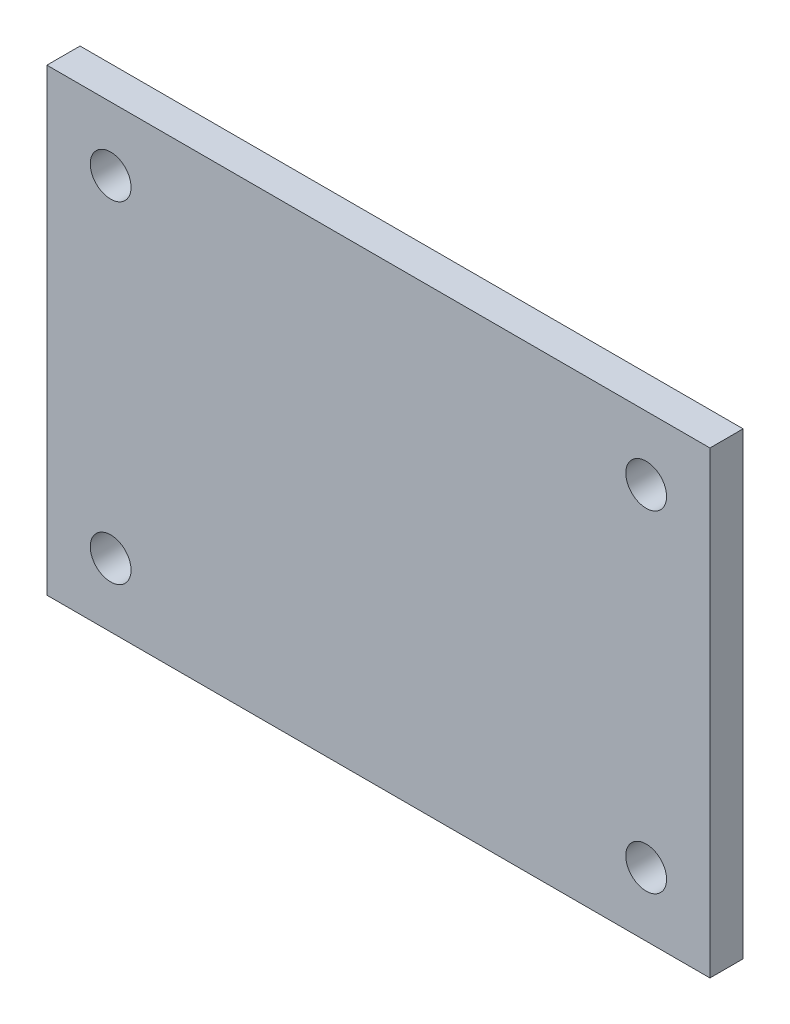
from build123d import *

# Parameters (mm, degrees)
ESQUISSE1_W               = 26
ESQUISSE1_H               = 18
BOSS_EXTRU_1_DEPTH        = 1.3
TROU_TARAUD_M2X0_41_D     = 1.6
TROU_TARAUD_M2X0_41_DEPTH = 1.3
TROU_TARAUD_M2X0_41_TIP   = 0.480688495


with BuildPart() as part:
    # Esquisse1 → Boss.-Extru.1 (new body)
    with BuildSketch(Plane.XY):
        Rectangle(ESQUISSE1_W, ESQUISSE1_H)
    extrude(amount=BOSS_EXTRU_1_DEPTH)

    # Trou taraudé M2x0.41
    with Locations(Plane(origin=(-10.5, 6.5, 1.3), x_dir=(1, 0, 0), z_dir=(0, 0, 1))):
        with Locations((0, 0), (0, -13), (21, -13), (21, 0)):
            Hole(TROU_TARAUD_M2X0_41_D / 2, depth=TROU_TARAUD_M2X0_41_DEPTH)
            with Locations((0, 0, -(TROU_TARAUD_M2X0_41_DEPTH + TROU_TARAUD_M2X0_41_TIP / 2))):  # 118° drill point
                Cone(0, TROU_TARAUD_M2X0_41_D / 2, TROU_TARAUD_M2X0_41_TIP, mode=Mode.SUBTRACT)


solid = part.part
